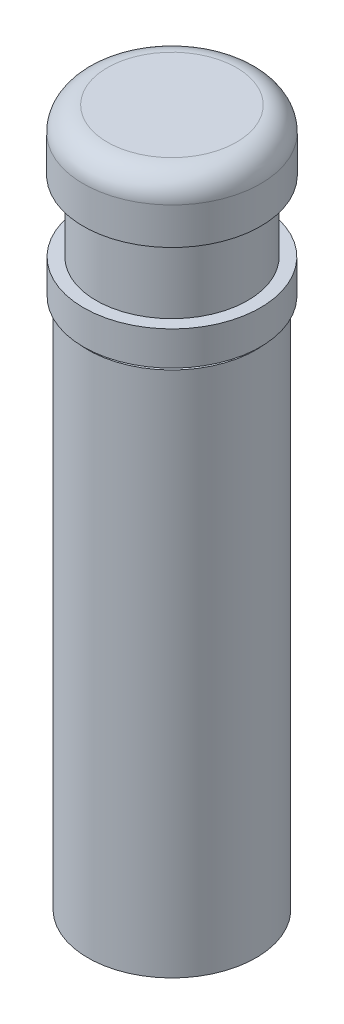
from build123d import *


with BuildPart() as part:
    # 草图1 → 旋转4 (revolve)
    with BuildSketch(Plane(origin=(0, 0, 0), x_dir=(0, 0, -1), z_dir=(1, 0, 0)), mode=Mode.PRIVATE) as revolve_4_sk:
        with BuildLine():
            Line((-7, 0), (0, 0))
            Line((0, 0), (0, 58))
            Line((0, 58), (-5.378171024, 58))
            ThreePointArc((-5.378171024, 58), (-6.792384586, 57.414213562), (-7.378171024, 56))
            Line((-7.378171024, 56), (-7.378171024, 52.933330123))
            Line((-7.378171024, 52.933330123), (-6.309364611, 52.933330123))
            Line((-6.309364611, 52.933330123), (-6.309364611, 47.048318533))
            Line((-6.309364611, 47.048318533), (-7.354829453, 47.048318533))
            Line((-7.354829453, 47.048318533), (-7.354829453, 44.220608725))
            Line((-7.354829453, 44.220608725), (-6.309364611, 44.220608725))
            Line((-6.309364611, 44.220608725), (-6.309364611, 43.835644878))
            Line((-6.309364611, 43.835644878), (-7, 43.835644878))
            Line((-7, 43.835644878), (-7, 0))
        make_face()
    revolve(revolve_4_sk.sketch.rotate(Axis((0, 0, 0), (0, 1, 0)), 180), axis=Axis((0, 0, 0), (0, 1, 0)))


solid = part.part
